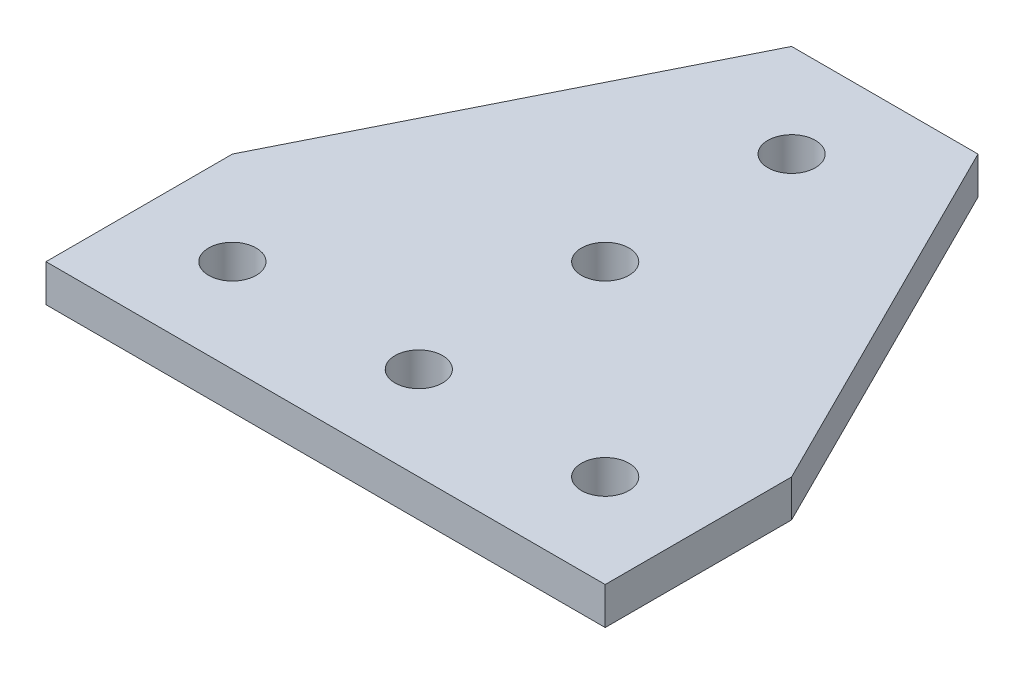
from build123d import *

# Parameters (mm, degrees)
SKETCH1_R           = 2.55
BOSS_EXTRUDE1_DEPTH = 4


with BuildPart() as part:
    # Sketch1 → Boss-Extrude1 (new body)
    with BuildSketch(Plane(origin=(0, 0, 0), x_dir=(1, 0, 0), z_dir=(0, 1, 0))):
        Polygon((30, -10), (-30, -10), (-30, 10), (-10, 50), (10, 50), (30, 10), align=None)
        with Locations(Location((-20, 0, 0), (0, 0, 270))):
            Circle(SKETCH1_R, mode=Mode.SUBTRACT)
        with Locations(Location((20, 0, 0), (0, 0, 270))):
            Circle(SKETCH1_R, mode=Mode.SUBTRACT)
        with Locations(Location((0, 0, 0), (0, 0, 270))):
            Circle(SKETCH1_R, mode=Mode.SUBTRACT)
        with Locations(Location((0, 20, 0), (0, 0, 270))):
            Circle(SKETCH1_R, mode=Mode.SUBTRACT)
        with Locations(Location((0, 40, 0), (0, 0, 270))):
            Circle(SKETCH1_R, mode=Mode.SUBTRACT)
    extrude(amount=BOSS_EXTRUDE1_DEPTH)


solid = part.part
